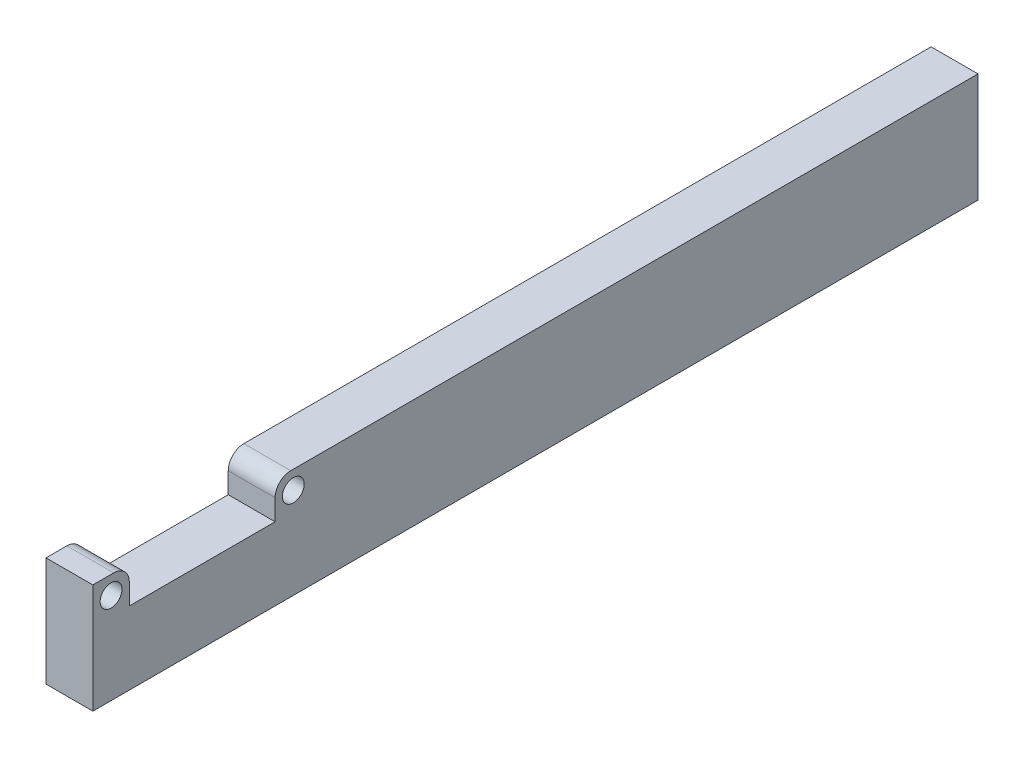
from build123d import *

# Parameters (mm, degrees)
SKETCH1_W               = 170
SKETCH1_H               = 21
BOSS_EXTRUDE1_DEPTH     = 4.5
CUT_EXTRUDE2_DEPTH      = 172.351247442
CUT_EXTRUDE2_DEPTH_BACK = 172.351247442
M4_CLEARANCE_HOLE1_D    = 4.2
FILLET1_R               = 3


with BuildPart() as part:
    # Sketch1 → Boss-Extrude1 (new, symmetric)
    with BuildSketch(Plane(origin=(0, 0, 0), x_dir=(0, 0, -1), z_dir=(1, 0, 0))):
        with Locations((85, 10.5)):
            Rectangle(SKETCH1_W, SKETCH1_H)
    extrude(amount=BOSS_EXTRUDE1_DEPTH, both=True)

    # Sketch3 → Cut-Extrude2 (cut, two sides: drawn at the far end of the back side and taken through both)
    with BuildSketch(Plane(origin=(0, 0, 0), x_dir=(0, 0, -1), z_dir=(1, 0, 0)).offset(-CUT_EXTRUDE2_DEPTH_BACK)):
        Polygon((0, 56), (42, 56), (42, 21), (35, 21), (35, 14), (7, 14), (7, 21), (0, 21), align=None)
    extrude(amount=CUT_EXTRUDE2_DEPTH + CUT_EXTRUDE2_DEPTH_BACK, mode=Mode.SUBTRACT)

    # M4 Clearance Hole1 (through all)
    with Locations(Plane(origin=(4.5, 0, 0), x_dir=(0, 0, -1), z_dir=(1, 0, 0))):
        with Locations((3.5, 17.5), (38.5, 17.5)):
            Hole(M4_CLEARANCE_HOLE1_D / 2)

    # Fillet1
    fillet1_edges = [part.edges().sort_by_distance(p)[0] for p in [
        (0, 21, -35),
        (0, 21, -7),
    ]]
    fillet(fillet1_edges, radius=FILLET1_R)


solid = part.part
